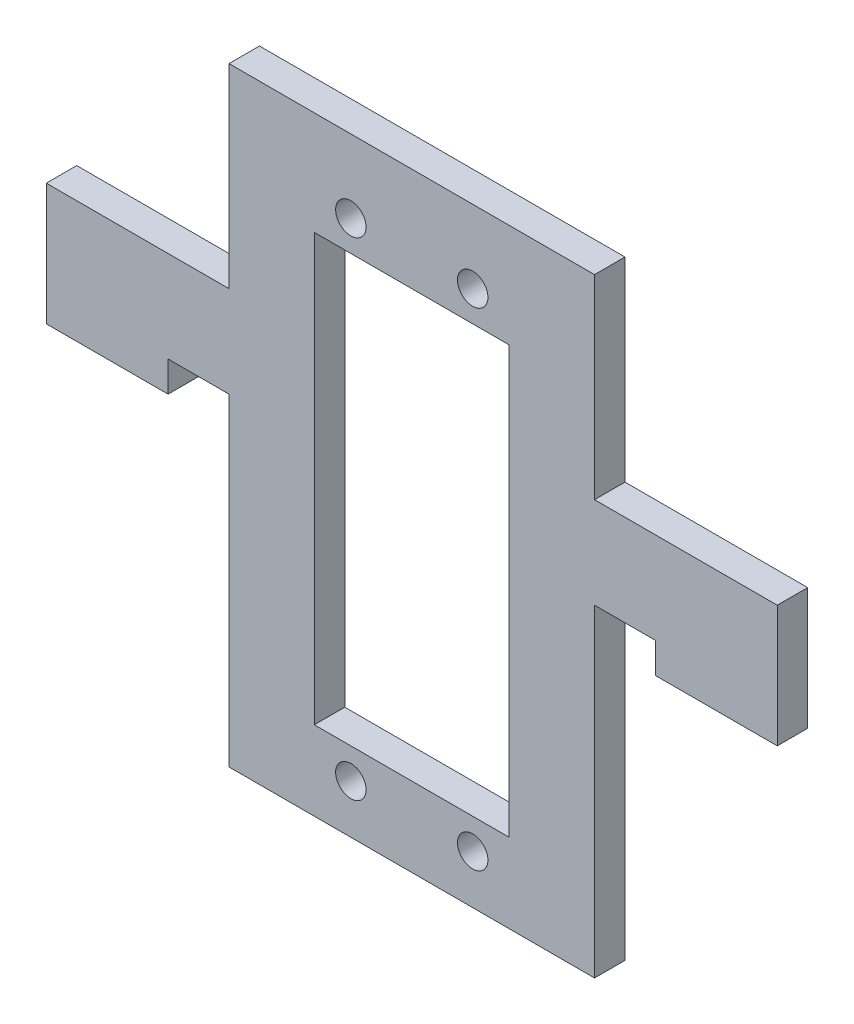
from build123d import *

# Parameters (mm, degrees)
SKETCH1_R           = 1.5875
SKETCH1_W           = 20.32
SKETCH1_H           = 44.45
BOSS_EXTRUDE1_DEPTH = 3.175


with BuildPart() as part:
    # Sketch1 → Boss-Extrude1 (new body)
    with BuildSketch(Plane.XY):
        Polygon((-8.89, 25.4), (-15.24, 25.4), (-15.24, 22.225), (-27.94, 22.225), (-27.94, 34.925), (-8.89, 34.925), (-8.89, 55.245), (29.21, 55.245), (29.21, 34.925), (48.26, 34.925), (48.26, 22.225), (35.56, 22.225), (35.56, 25.4), (29.21, 25.4), (29.21, -8.255), (-8.89, -8.255), align=None)
        with Locations((3.81, 47.625)):
            Circle(SKETCH1_R, mode=Mode.SUBTRACT)
        with Locations((16.51, 47.625)):
            Circle(SKETCH1_R, mode=Mode.SUBTRACT)
        with Locations(Location((16.51, -3.175, 0), (0, 0, 180))):
            Circle(SKETCH1_R, mode=Mode.SUBTRACT)
        with Locations(Location((3.81, -3.175, 0), (0, 0, 180))):
            Circle(SKETCH1_R, mode=Mode.SUBTRACT)
        with Locations((10.16, 22.225)):
            Rectangle(SKETCH1_W, SKETCH1_H, mode=Mode.SUBTRACT)
    extrude(amount=BOSS_EXTRUDE1_DEPTH)


solid = part.part
